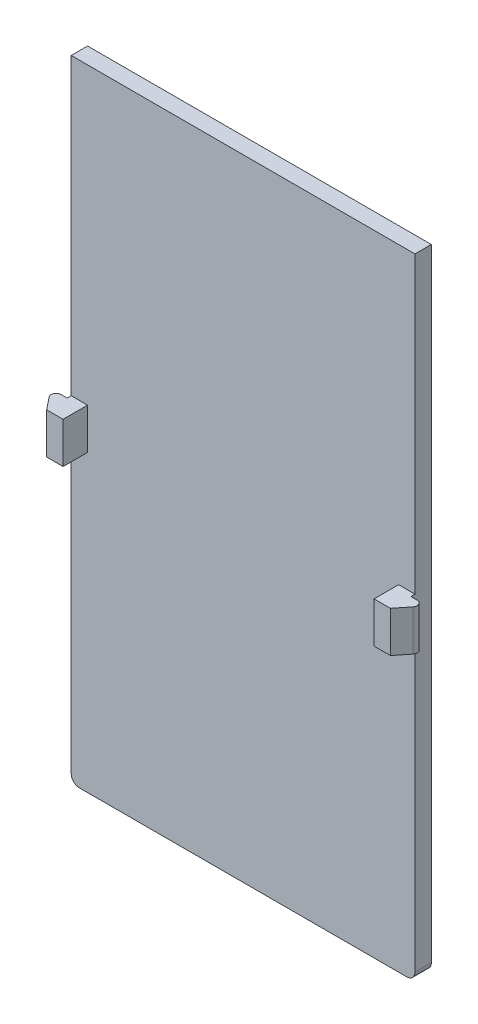
from build123d import *

# Parameters (mm, degrees)
SKETCH1_W           = 46
SKETCH1_H           = 79
BOSS_EXTRUDE1_DEPTH = 2
SKETCH2_W           = 2
SKETCH2_H           = 5
BOSS_EXTRUDE2_DEPTH = 3
BOSS_EXTRUDE3_DEPTH = 5
FILLET1_R           = 0.6
SKETCH4_W           = 46
SKETCH4_H           = 79
SKETCH4_W_2         = 42
SKETCH4_H_2         = 75
CUT_EXTRUDE1_DEPTH  = 10
SKETCH5_W           = 42
SKETCH5_H           = 1
BOSS_EXTRUDE4_DEPTH = 2
SKETCH6_W           = 42
SKETCH6_H           = 1
BOSS_EXTRUDE5_DEPTH = 2
FILLET2_R           = 1
SKETCH7_W           = 5.220052767
SKETCH7_H           = 2.493732105
SKETCH7_W_2         = 4.447072359
SKETCH7_H_2         = 2.905988322
CUT_EXTRUDE2_DEPTH  = 10
BOSS_EXTRUDE6_DEPTH = 5
FILLET3_R           = 0.6


with BuildPart() as part:
    # Sketch1 → Boss-Extrude1 (new body)
    with BuildSketch(Plane.XY):
        with Locations((23, -39.5)):
            Rectangle(SKETCH1_W, SKETCH1_H)
    extrude(amount=BOSS_EXTRUDE1_DEPTH)

    # Sketch2 → Boss-Extrude2 (add)
    with BuildSketch(Plane.XY.offset(2)):
        with Locations((3, -38.5)):
            Rectangle(SKETCH2_W, SKETCH2_H)
        with Locations((43, -38.5)):
            Rectangle(SKETCH2_W, SKETCH2_H)
    extrude(amount=BOSS_EXTRUDE2_DEPTH)

    # Sketch3 → Boss-Extrude3 (add)
    with BuildSketch(Plane.XZ.offset(41)):
        Polygon((2, 7), (0, 5), (2, 5), (4, 5), (4, 7), align=None)
        Polygon((44, 7), (42, 7), (42, 5), (46, 5), align=None)
    extrude(amount=-BOSS_EXTRUDE3_DEPTH)

    # Fillet1
    fillet1_edges = [part.edges().sort_by_distance(p)[0] for p in [
        (0, -38.5, 5),
        (46, -38.5, 5),
    ]]
    fillet(fillet1_edges, radius=FILLET1_R)

    # Sketch4 → Cut-Extrude1 (cut)
    with BuildSketch(Plane.XY.offset(2)):
        with Locations((23, -39.5)):
            Rectangle(SKETCH4_W, SKETCH4_H)
        with Locations((23, -39.5)):
            Rectangle(SKETCH4_W_2, SKETCH4_H_2, mode=Mode.SUBTRACT)
    extrude(amount=-CUT_EXTRUDE1_DEPTH, mode=Mode.SUBTRACT)

    # Sketch5 → Boss-Extrude4 (add)
    with BuildSketch(Plane.XY.offset(2)):
        with Locations((23, -1.5)):
            Rectangle(SKETCH5_W, SKETCH5_H)
    extrude(amount=-BOSS_EXTRUDE4_DEPTH)

    # Sketch6 → Boss-Extrude5 (add)
    with BuildSketch(Plane.XY.offset(2)):
        with Locations((23, -0.5)):
            Rectangle(SKETCH6_W, SKETCH6_H)
    extrude(amount=-BOSS_EXTRUDE5_DEPTH)

    # Fillet2
    fillet2_edges = [part.edges().sort_by_distance(p)[0] for p in [
        (44, -77, 1),
        (2, -77, 1),
    ]]
    fillet(fillet2_edges, radius=FILLET2_R)

    # Sketch7 → Cut-Extrude2 (cut)
    with BuildSketch(Plane.XZ.offset(41)):
        with Locations((1.389973616, 6.246866052)):
            Rectangle(SKETCH7_W, SKETCH7_H)
        with Locations((44.22353618, 6.452994161)):
            Rectangle(SKETCH7_W_2, SKETCH7_H_2)
    extrude(amount=-CUT_EXTRUDE2_DEPTH, mode=Mode.SUBTRACT)

    # Sketch8 → Boss-Extrude6 (add)
    with BuildSketch(Plane.XZ.offset(41)):
        Polygon((2, 5), (0, 2.5), (4, 2.5), (4, 5), align=None)
        Polygon((42, 2.5), (46, 2.5), (44, 5), (42, 5), align=None)
    extrude(amount=-BOSS_EXTRUDE6_DEPTH)

    # Fillet3
    fillet3_edges = [part.edges().sort_by_distance(p)[0] for p in [
        (0, -38.5, 2.5),
        (46, -38.5, 2.5),
    ]]
    fillet(fillet3_edges, radius=FILLET3_R)


solid = part.part
